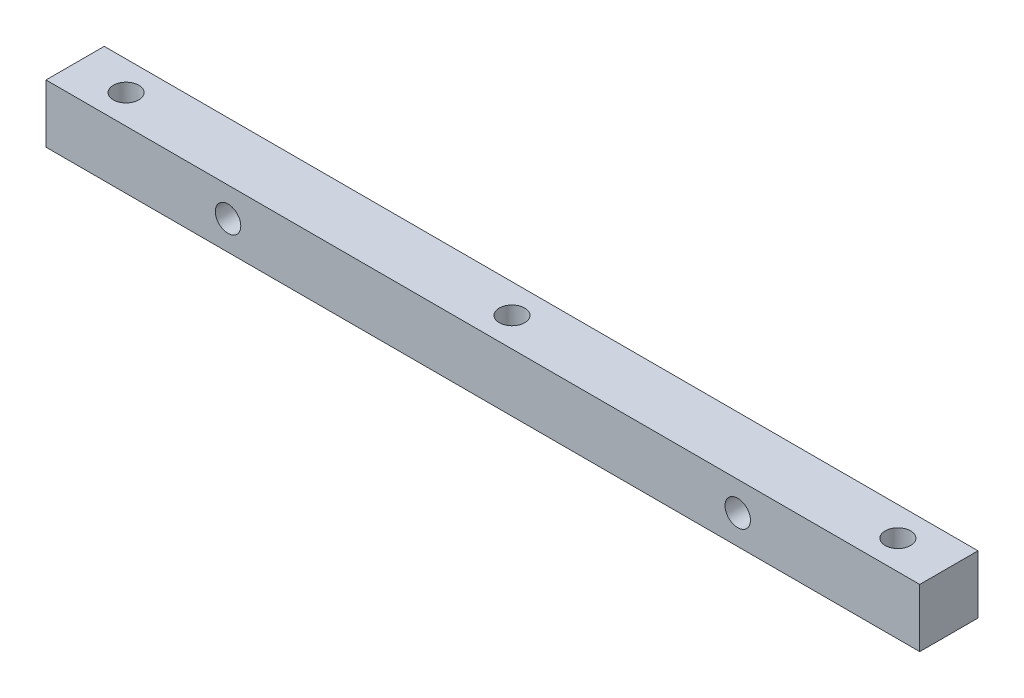
from build123d import *

# Parameters (mm, degrees)
SKIZZE1_W                       = 120
SKIZZE1_H                       = 8
SKIZZE1_R                       = 1.75
AUFSATZ_LINEAR_AUSTRAGEN1_DEPTH = 8
SKIZZE2_R                       = 1.75
SCHNITT_LINEAR_AUSTRAGEN1_DEPTH = 62.05735009


with BuildPart() as part:
    # Skizze1 → Aufsatz-Linear austragen1 (new body)
    with BuildSketch(Plane.XY):
        Rectangle(SKIZZE1_W, SKIZZE1_H)
        with Locations((-35, 0)):
            Circle(SKIZZE1_R, mode=Mode.SUBTRACT)
        with Locations((35, 0)):
            Circle(SKIZZE1_R, mode=Mode.SUBTRACT)
    extrude(amount=AUFSATZ_LINEAR_AUSTRAGEN1_DEPTH)

    # Skizze2 → Schnitt-Linear austragen1 (cut, through all)
    with BuildSketch(Plane(origin=(0, 4, 0), x_dir=(1, 0, 0), z_dir=(0, 1, 0))):
        with Locations(Location((53, -4, 0), (0, 0, 270))):
            Circle(SKIZZE2_R)
        with Locations(Location((-53, -4, 0), (0, 0, 90))):
            Circle(SKIZZE2_R)
        with Locations(Location((0, -4, 0), (0, 0, 270))):
            Circle(SKIZZE2_R)
    extrude(amount=-SCHNITT_LINEAR_AUSTRAGEN1_DEPTH, mode=Mode.SUBTRACT)


solid = part.part
